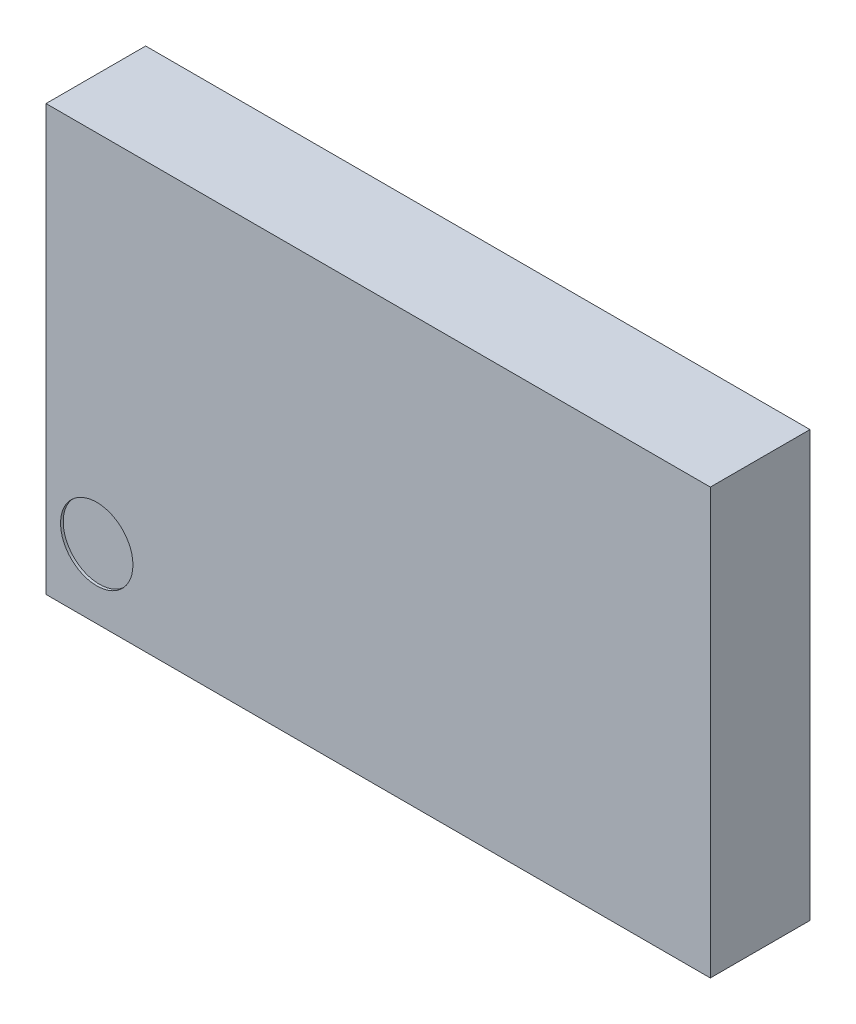
from build123d import *

# Parameters (mm, degrees)
SKETCH1_W            = 5
SKETCH1_H            = 3.2
BOSS_EXTRUDE1_DEPTH  = 0.75
BOSS_EXTRUDE2_DEPTH  = 0.02
LPATTERN1_COUNT      = 3
LPATTERN1_PITCH      = 1.27
MIRROR1_COPY_1_DEPTH = 0.02
MIRROR1_COPY_2_DEPTH = 0.02
SKETCH3_R            = 0.272413565
CUT_EXTRUDE1_DEPTH   = 0.02


with BuildPart() as part:
    # Sketch1 → Boss-Extrude1 (new body)
    with BuildSketch(Plane.XY):
        Rectangle(SKETCH1_W, SKETCH1_H)
    extrude(amount=BOSS_EXTRUDE1_DEPTH)

    # Sketch2 → Boss-Extrude2 (add)
    with BuildSketch(Plane(origin=(0, 0, 0), x_dir=(-1, 0, 0), z_dir=(0, 0, -1))):
        with BuildLine():
            Line((-1.54, 1.466183209), (-1, 1.466183209))
            ThreePointArc((-1, 1.466183209), (-0.964644661, 1.451538548), (-0.95, 1.416183209))
            Line((-0.95, 1.416183209), (-0.95, 0.716183209))
            ThreePointArc((-0.95, 0.716183209), (-0.993933983, 0.610117192), (-1.1, 0.566183209))
            Line((-1.1, 0.566183209), (-1.44, 0.566183209))
            ThreePointArc((-1.44, 0.566183209), (-1.546066017, 0.610117192), (-1.59, 0.716183209))
            Line((-1.59, 0.716183209), (-1.59, 1.416183209))
            ThreePointArc((-1.59, 1.416183209), (-1.575355339, 1.451538548), (-1.54, 1.466183209))
        make_face()
    boss_extrude2 = extrude(amount=BOSS_EXTRUDE2_DEPTH)

    # LPattern1: Boss-Extrude2 ×3
    with Locations(*[(-i * LPATTERN1_PITCH, 0, 0) for i in range(1, LPATTERN1_COUNT)]):
        add(boss_extrude2)

    # Mirror1: Boss-Extrude2 across plane
    add(boss_extrude2.mirror(Plane.ZX))

    # Mirror1 copy 1 sketch → Mirror1 copy 1 (add)
    with BuildSketch(Plane(origin=(-1.27, 0, 0), x_dir=(-1, 0, 0), z_dir=(0, 0, -1))):
        with BuildLine():
            Line((-1.54, -1.466183209), (-1, -1.466183209))
            ThreePointArc((-1, -1.466183209), (-0.964644661, -1.451538548), (-0.95, -1.416183209))
            Line((-0.95, -1.416183209), (-0.95, -0.716183209))
            ThreePointArc((-0.95, -0.716183209), (-0.993933983, -0.610117192), (-1.1, -0.566183209))
            Line((-1.1, -0.566183209), (-1.44, -0.566183209))
            ThreePointArc((-1.44, -0.566183209), (-1.546066017, -0.610117192), (-1.59, -0.716183209))
            Line((-1.59, -0.716183209), (-1.59, -1.416183209))
            ThreePointArc((-1.59, -1.416183209), (-1.575355339, -1.451538548), (-1.54, -1.466183209))
        make_face()
    extrude(amount=MIRROR1_COPY_1_DEPTH)

    # Mirror1 copy 2 sketch → Mirror1 copy 2 (add)
    with BuildSketch(Plane(origin=(-2.54, 0, 0), x_dir=(-1, 0, 0), z_dir=(0, 0, -1))):
        with BuildLine():
            Line((-1.54, -1.466183209), (-1, -1.466183209))
            ThreePointArc((-1, -1.466183209), (-0.964644661, -1.451538548), (-0.95, -1.416183209))
            Line((-0.95, -1.416183209), (-0.95, -0.716183209))
            ThreePointArc((-0.95, -0.716183209), (-0.993933983, -0.610117192), (-1.1, -0.566183209))
            Line((-1.1, -0.566183209), (-1.44, -0.566183209))
            ThreePointArc((-1.44, -0.566183209), (-1.546066017, -0.610117192), (-1.59, -0.716183209))
            Line((-1.59, -0.716183209), (-1.59, -1.416183209))
            ThreePointArc((-1.59, -1.416183209), (-1.575355339, -1.451538548), (-1.54, -1.466183209))
        make_face()
    extrude(amount=MIRROR1_COPY_2_DEPTH)

    # Sketch3 → Cut-Extrude1 (cut)
    with BuildSketch(Plane.XY.offset(0.75)):
        with Locations((-2.118285692, -1.080463464)):
            Circle(SKETCH3_R)
    extrude(amount=-CUT_EXTRUDE1_DEPTH, mode=Mode.SUBTRACT)


solid = part.part
